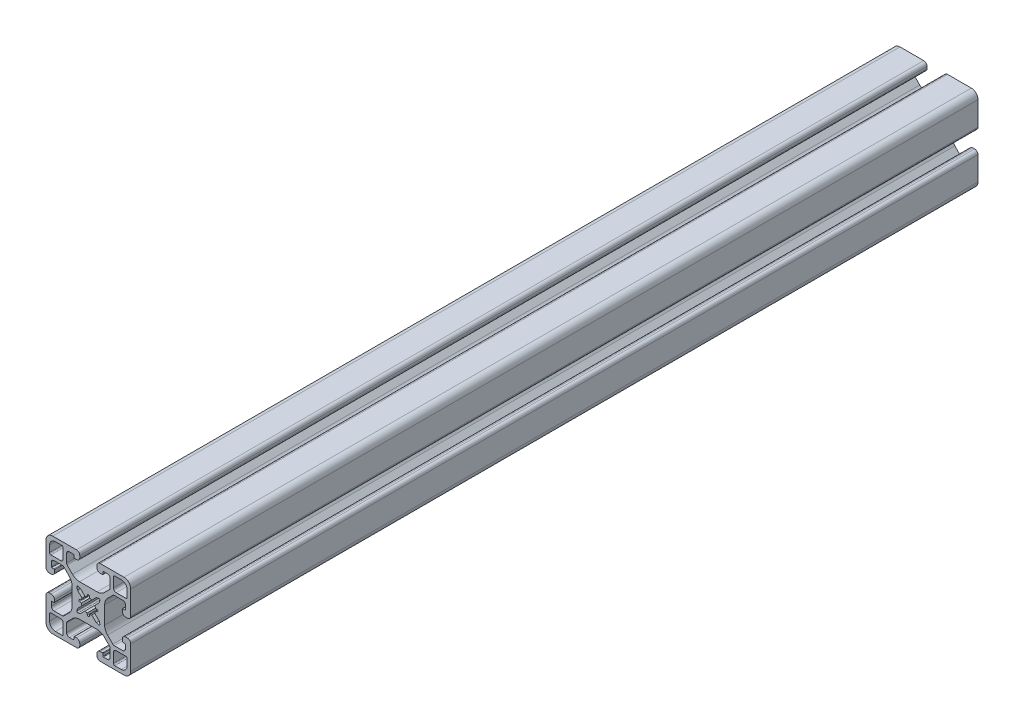
from build123d import *

# Parameters (mm, degrees)
EXTRUDE1_DEPTH = 400


with BuildPart() as part:
    # Sketch1 → Extrude1 (new body)
    with BuildSketch(Plane.XY):
        with BuildLine():
            Line((-5.63, 20), (-16.83, 20))
            ThreePointArc((-16.83, 20), (-19.071528496, 19.071528497), (-20, 16.83))
            Line((-20, 16.83), (-20, 5.63))
            ThreePointArc((-20, 5.63), (-19.540157646, 4.519842354), (-18.43, 4.06))
            Line((-18.43, 4.06), (-17.57, 4.06))
            ThreePointArc((-17.57, 4.06), (-16.459842353, 4.519842354), (-16, 5.63))
            Line((-16, 5.63), (-16, 6.605))
            ThreePointArc((-16, 6.605), (-16.073223305, 6.781776695), (-16.25, 6.855))
            Line((-16.25, 6.855), (-17.25, 6.855))
            ThreePointArc((-17.25, 6.855), (-17.426776695, 6.928223305), (-17.5, 7.105))
            Line((-17.5, 7.105), (-17.5, 9.015))
            ThreePointArc((-17.5, 9.015), (-17.128025612, 9.913025612), (-16.23, 10.285))
            Line((-16.23, 10.285), (-12.216214636, 10.285))
            ThreePointArc((-12.216214636, 10.285), (-11.875626381, 10.217252784), (-11.5868896, 10.024325035))
            Line((-11.5868896, 10.024325035), (-9.076242789, 7.513678224))
            ThreePointArc((-9.076242789, 7.513678224), (-8.046572221, 5.972667318), (-7.685, 4.154921014))
            Line((-7.685, 4.154921014), (-7.685, -4.154921014))
            ThreePointArc((-7.685, -4.154921014), (-8.046572221, -5.972667317), (-9.076242789, -7.513678224))
            Line((-9.076242789, -7.513678224), (-11.5868896, -10.024325035))
            ThreePointArc((-11.5868896, -10.024325035), (-11.875626381, -10.217252784), (-12.216214636, -10.285))
            Line((-12.216214636, -10.285), (-16.23, -10.285))
            ThreePointArc((-16.23, -10.285), (-17.128025612, -9.913025612), (-17.5, -9.015))
            Line((-17.5, -9.015), (-17.5, -7.105))
            ThreePointArc((-17.5, -7.105), (-17.426776695, -6.928223305), (-17.25, -6.855))
            Line((-17.25, -6.855), (-16.25, -6.855))
            ThreePointArc((-16.25, -6.855), (-16.073223305, -6.781776695), (-16, -6.605))
            Line((-16, -6.605), (-16, -5.63))
            ThreePointArc((-16, -5.63), (-16.459842354, -4.519842353), (-17.57, -4.06))
            Line((-17.57, -4.06), (-18.43, -4.06))
            ThreePointArc((-18.43, -4.06), (-19.540157646, -4.519842353), (-20, -5.63))
            Line((-20, -5.63), (-20, -16.83))
            ThreePointArc((-20, -16.83), (-19.071528496, -19.071528496), (-16.83, -20))
            Line((-16.83, -20), (-5.63, -20))
            ThreePointArc((-5.63, -20), (-4.519842354, -19.540157646), (-4.06, -18.43))
            Line((-4.06, -18.43), (-4.06, -17.57))
            ThreePointArc((-4.06, -17.57), (-4.519842354, -16.459842353), (-5.63, -16))
            Line((-5.63, -16), (-6.605, -16))
            ThreePointArc((-6.605, -16), (-6.781776695, -16.073223305), (-6.855, -16.25))
            Line((-6.855, -16.25), (-6.855, -17.25))
            ThreePointArc((-6.855, -17.25), (-6.928223305, -17.426776695), (-7.105, -17.5))
            Line((-7.105, -17.5), (-9.015, -17.5))
            ThreePointArc((-9.015, -17.5), (-9.913025612, -17.128025612), (-10.285, -16.23))
            Line((-10.285, -16.23), (-10.285, -12.216214635))
            ThreePointArc((-10.285, -12.216214635), (-10.217252784, -11.875626381), (-10.024325035, -11.5868896))
            Line((-10.024325035, -11.5868896), (-7.513678224, -9.076242789))
            ThreePointArc((-7.513678224, -9.076242789), (-5.972667317, -8.04657222), (-4.154921014, -7.685))
            Line((-4.154921014, -7.685), (4.154921014, -7.685))
            ThreePointArc((4.154921014, -7.685), (5.972667317, -8.04657222), (7.513678224, -9.076242789))
            Line((7.513678224, -9.076242789), (10.024325035, -11.5868896))
            ThreePointArc((10.024325035, -11.5868896), (10.217252784, -11.875626381), (10.285, -12.216214636))
            Line((10.285, -12.216214636), (10.285, -16.23))
            ThreePointArc((10.285, -16.23), (9.913025612, -17.128025612), (9.015, -17.5))
            Line((9.015, -17.5), (7.105, -17.5))
            ThreePointArc((7.105, -17.5), (6.928223305, -17.426776695), (6.855, -17.25))
            Line((6.855, -17.25), (6.855, -16.25))
            ThreePointArc((6.855, -16.25), (6.781776695, -16.073223305), (6.605, -16))
            Line((6.605, -16), (5.63, -16))
            ThreePointArc((5.63, -16), (4.519842354, -16.459842353), (4.06, -17.57))
            Line((4.06, -17.57), (4.06, -18.43))
            ThreePointArc((4.06, -18.43), (4.519842354, -19.540157646), (5.63, -20))
            Line((5.63, -20), (16.83, -20))
            ThreePointArc((16.83, -20), (19.071528496, -19.071528496), (20, -16.83))
            Line((20, -16.83), (20, -5.63))
            ThreePointArc((20, -5.63), (19.540157646, -4.519842353), (18.43, -4.06))
            Line((18.43, -4.06), (17.57, -4.06))
            ThreePointArc((17.57, -4.06), (16.459842354, -4.519842353), (16, -5.63))
            Line((16, -5.63), (16, -6.605))
            ThreePointArc((16, -6.605), (16.073223305, -6.781776695), (16.25, -6.855))
            Line((16.25, -6.855), (17.25, -6.855))
            ThreePointArc((17.25, -6.855), (17.426776695, -6.928223305), (17.5, -7.105))
            Line((17.5, -7.105), (17.5, -9.015))
            ThreePointArc((17.5, -9.015), (17.128025612, -9.913025612), (16.23, -10.285))
            Line((16.23, -10.285), (12.216214636, -10.285))
            ThreePointArc((12.216214636, -10.285), (11.875626381, -10.217252784), (11.5868896, -10.024325035))
            Line((11.5868896, -10.024325035), (9.076242789, -7.513678224))
            ThreePointArc((9.076242789, -7.513678224), (8.046572221, -5.972667317), (7.685, -4.154921014))
            Line((7.685, -4.154921014), (7.685, 4.154921014))
            ThreePointArc((7.685, 4.154921014), (8.046572221, 5.972667318), (9.076242789, 7.513678224))
            Line((9.076242789, 7.513678224), (11.5868896, 10.024325035))
            ThreePointArc((11.5868896, 10.024325035), (11.875626381, 10.217252784), (12.216214636, 10.285))
            Line((12.216214636, 10.285), (16.23, 10.285))
            ThreePointArc((16.23, 10.285), (17.128025612, 9.913025612), (17.5, 9.015))
            Line((17.5, 9.015), (17.5, 7.105))
            ThreePointArc((17.5, 7.105), (17.426776695, 6.928223305), (17.25, 6.855))
            Line((17.25, 6.855), (16.25, 6.855))
            ThreePointArc((16.25, 6.855), (16.073223305, 6.781776695), (16, 6.605))
            Line((16, 6.605), (16, 5.63))
            ThreePointArc((16, 5.63), (16.459842354, 4.519842354), (17.57, 4.06))
            Line((17.57, 4.06), (18.43, 4.06))
            ThreePointArc((18.43, 4.06), (19.540157646, 4.519842354), (20, 5.63))
            Line((20, 5.63), (20, 16.83))
            ThreePointArc((20, 16.83), (19.071528496, 19.071528496), (16.83, 20))
            Line((16.83, 20), (5.63, 20))
            ThreePointArc((5.63, 20), (4.519842354, 19.540157647), (4.06, 18.43))
            Line((4.06, 18.43), (4.06, 17.57))
            ThreePointArc((4.06, 17.57), (4.519842354, 16.459842354), (5.63, 16))
            Line((5.63, 16), (6.605, 16))
            ThreePointArc((6.605, 16), (6.781776695, 16.073223305), (6.855, 16.25))
            Line((6.855, 16.25), (6.855, 17.25))
            ThreePointArc((6.855, 17.25), (6.928223305, 17.426776695), (7.105, 17.5))
            Line((7.105, 17.5), (9.015, 17.5))
            ThreePointArc((9.015, 17.5), (9.913025612, 17.128025612), (10.285, 16.23))
            Line((10.285, 16.23), (10.285, 12.216214636))
            ThreePointArc((10.285, 12.216214636), (10.217252784, 11.875626381), (10.024325035, 11.5868896))
            Line((10.024325035, 11.5868896), (7.513678224, 9.07624279))
            ThreePointArc((7.513678224, 9.07624279), (5.972667317, 8.046572221), (4.154921014, 7.685))
            Line((4.154921014, 7.685), (-4.154921014, 7.685))
            ThreePointArc((-4.154921014, 7.685), (-5.972667317, 8.046572221), (-7.513678224, 9.07624279))
            Line((-7.513678224, 9.07624279), (-10.024325035, 11.5868896))
            ThreePointArc((-10.024325035, 11.5868896), (-10.217252784, 11.875626381), (-10.285, 12.216214636))
            Line((-10.285, 12.216214636), (-10.285, 16.23))
            ThreePointArc((-10.285, 16.23), (-9.913025612, 17.128025612), (-9.015, 17.5))
            Line((-9.015, 17.5), (-7.105, 17.5))
            ThreePointArc((-7.105, 17.5), (-6.928223305, 17.426776695), (-6.855, 17.25))
            Line((-6.855, 17.25), (-6.855, 16.25))
            ThreePointArc((-6.855, 16.25), (-6.781776695, 16.073223305), (-6.605, 16))
            Line((-6.605, 16), (-5.63, 16))
            ThreePointArc((-5.63, 16), (-4.519842354, 16.459842354), (-4.06, 17.57))
            Line((-4.06, 17.57), (-4.06, 18.43))
            ThreePointArc((-4.06, 18.43), (-4.519842354, 19.540157647), (-5.63, 20))
        make_face()
        with BuildLine():
            Line((12.4898, -18.345), (15.545, -18.345))
            ThreePointArc((15.545, -18.345), (17.524898987, -17.524898987), (18.345, -15.545))
            Line((18.345, -15.545), (18.345, -12.4898))
            ThreePointArc((18.345, -12.4898), (18.160477272, -12.044322728), (17.715, -11.8598))
            Line((17.715, -11.8598), (13.1298, -11.8598))
            ThreePointArc((13.1298, -11.8598), (12.231774388, -12.231774388), (11.8598, -13.1298))
            Line((11.8598, -13.1298), (11.8598, -17.715))
            ThreePointArc((11.8598, -17.715), (12.044322728, -18.160477272), (12.4898, -18.345))
        make_face(mode=Mode.SUBTRACT)
        with BuildLine():
            Line((-18.345, -12.4898), (-18.345, -15.545))
            ThreePointArc((-18.345, -15.545), (-17.524898987, -17.524898987), (-15.545, -18.345))
            Line((-15.545, -18.345), (-12.4898, -18.345))
            ThreePointArc((-12.4898, -18.345), (-12.044322728, -18.160477272), (-11.8598, -17.715))
            Line((-11.8598, -17.715), (-11.8598, -13.1298))
            ThreePointArc((-11.8598, -13.1298), (-12.231774388, -12.231774388), (-13.1298, -11.8598))
            Line((-13.1298, -11.8598), (-17.715, -11.8598))
            ThreePointArc((-17.715, -11.8598), (-18.160477272, -12.044322728), (-18.345, -12.4898))
        make_face(mode=Mode.SUBTRACT)
        with BuildLine():
            Line((18.345, 12.4898), (18.345, 15.545))
            ThreePointArc((18.345, 15.545), (17.524898987, 17.524898987), (15.545, 18.345))
            Line((15.545, 18.345), (12.4898, 18.345))
            ThreePointArc((12.4898, 18.345), (12.044322728, 18.160477272), (11.8598, 17.715))
            Line((11.8598, 17.715), (11.8598, 13.1298))
            ThreePointArc((11.8598, 13.1298), (12.231774388, 12.231774388), (13.1298, 11.8598))
            Line((13.1298, 11.8598), (17.715, 11.8598))
            ThreePointArc((17.715, 11.8598), (18.160477272, 12.044322728), (18.345, 12.4898))
        make_face(mode=Mode.SUBTRACT)
        with BuildLine():
            Line((-12.4898, 18.345), (-15.545, 18.345))
            ThreePointArc((-15.545, 18.345), (-17.524898987, 17.524898987), (-18.345, 15.545))
            Line((-18.345, 15.545), (-18.345, 12.4898))
            ThreePointArc((-18.345, 12.4898), (-18.160477272, 12.044322728), (-17.715, 11.8598))
            Line((-17.715, 11.8598), (-13.1298, 11.8598))
            ThreePointArc((-13.1298, 11.8598), (-12.231774388, 12.231774388), (-11.8598, 13.1298))
            Line((-11.8598, 13.1298), (-11.8598, 17.715))
            ThreePointArc((-11.8598, 17.715), (-12.044322728, 18.160477272), (-12.4898, 18.345))
        make_face(mode=Mode.SUBTRACT)
        with BuildLine():
            Line((-4.84811685, -5.43930974), (-3.712038621, -5.126252183))
            Line((-3.712038621, -5.126252183), (-1.590718277, -3.00493184))
            ThreePointArc((-1.590718277, -3.00493184), (-1.120609643, -3.210020877), (-0.625, -3.342061489))
            Line((-0.625, -3.342061489), (-0.492259234, -4.087640441))
            ThreePointArc((-0.492259234, -4.087640441), (0, -4.5), (0.492259234, -4.087640441))
            Line((0.492259234, -4.087640441), (0.625, -3.342061489))
            ThreePointArc((0.625, -3.342061489), (1.120609643, -3.210020877), (1.590718277, -3.00493184))
            Line((1.590718277, -3.00493184), (3.712038621, -5.126252183))
            Line((3.712038621, -5.126252183), (4.84811685, -5.43930974))
            ThreePointArc((4.84811685, -5.43930974), (5.303300859, -5.303300859), (5.43930974, -4.84811685))
            Line((5.43930974, -4.84811685), (5.126252183, -3.712038621))
            Line((5.126252183, -3.712038621), (3.00493184, -1.590718277))
            ThreePointArc((3.00493184, -1.590718277), (3.210020877, -1.120609643), (3.342061489, -0.625))
            Line((3.342061489, -0.625), (4.087640441, -0.492259234))
            ThreePointArc((4.087640441, -0.492259234), (4.5, 0), (4.087640441, 0.492259234))
            Line((4.087640441, 0.492259234), (3.342061489, 0.625))
            ThreePointArc((3.342061489, 0.625), (3.210020877, 1.120609643), (3.00493184, 1.590718277))
            Line((3.00493184, 1.590718277), (5.126252183, 3.712038621))
            Line((5.126252183, 3.712038621), (5.43930974, 4.84811685))
            ThreePointArc((5.43930974, 4.84811685), (5.303300859, 5.303300859), (4.84811685, 5.43930974))
            Line((4.84811685, 5.43930974), (3.712038621, 5.126252183))
            Line((3.712038621, 5.126252183), (1.590718277, 3.00493184))
            ThreePointArc((1.590718277, 3.00493184), (1.120609643, 3.210020877), (0.625, 3.342061489))
            Line((0.625, 3.342061489), (0.492259234, 4.087640441))
            ThreePointArc((0.492259234, 4.087640441), (0, 4.5), (-0.492259234, 4.087640441))
            Line((-0.492259234, 4.087640441), (-0.625, 3.342061489))
            ThreePointArc((-0.625, 3.342061489), (-1.120609643, 3.210020877), (-1.590718277, 3.00493184))
            Line((-1.590718277, 3.00493184), (-3.712038621, 5.126252183))
            Line((-3.712038621, 5.126252183), (-4.84811685, 5.43930974))
            ThreePointArc((-4.84811685, 5.43930974), (-5.303300859, 5.303300859), (-5.43930974, 4.84811685))
            Line((-5.43930974, 4.84811685), (-5.126252183, 3.712038621))
            Line((-5.126252183, 3.712038621), (-3.00493184, 1.590718277))
            ThreePointArc((-3.00493184, 1.590718277), (-3.210020877, 1.120609643), (-3.342061489, 0.625))
            Line((-3.342061489, 0.625), (-4.087640441, 0.492259234))
            ThreePointArc((-4.087640441, 0.492259234), (-4.5, 0), (-4.087640441, -0.492259234))
            Line((-4.087640441, -0.492259234), (-3.342061489, -0.625))
            ThreePointArc((-3.342061489, -0.625), (-3.210020877, -1.120609643), (-3.00493184, -1.590718277))
            Line((-3.00493184, -1.590718277), (-5.126252183, -3.712038621))
            Line((-5.126252183, -3.712038621), (-5.43930974, -4.84811685))
            ThreePointArc((-5.43930974, -4.84811685), (-5.303300859, -5.303300859), (-4.84811685, -5.43930974))
        make_face(mode=Mode.SUBTRACT)
    extrude(amount=-EXTRUDE1_DEPTH)


solid = part.part
